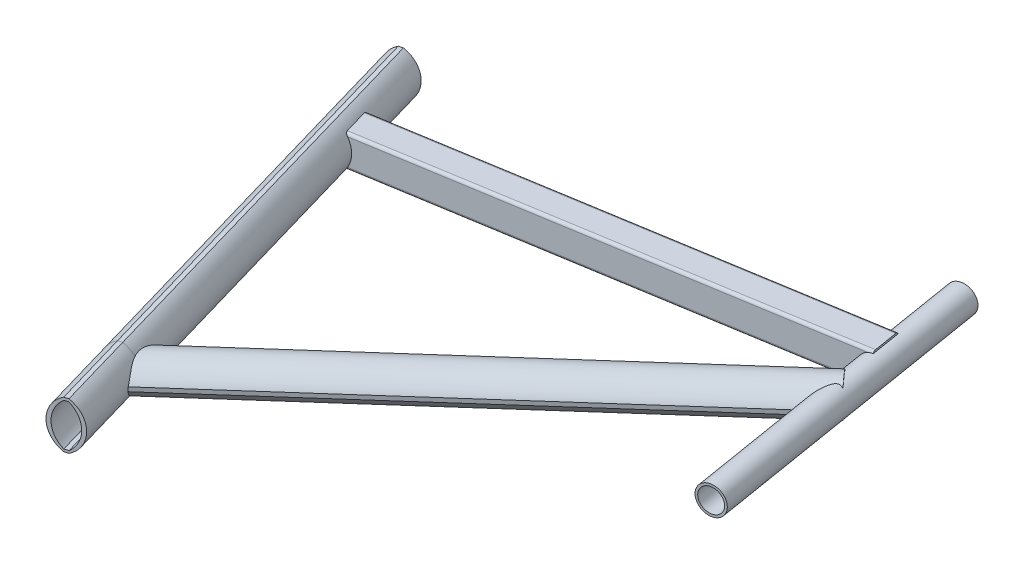
from build123d import *

# Parameters (mm, degrees)
SKETCH12_R                         = 15
SKETCH12_R_2                       = 12.5
BACK_FRAME_BACK_FRAME_1_DEPTH      = 439.089643257
SKETCH13_R                         = 15
SKETCH13_R_2                       = 12.5
BACK_FRAME_BACK_FRAME_2_DEPTH      = 324.083071196
TOP_FRAME_TOP_TUBE_1_DEPTH         = 505
LOWER_FRAME_BOTTOM_FRAME_1_DEPTH   = 547.875918564
LOWER_FRAME_BOTTOM_FRAME_2_DEPTH   = 84.118367958
LOWER_FRAME_BOTTOM_FRAME_2_2_DEPTH = 439.089643257


with BuildPart() as part:
    # Sketch12 → Back frame BACK FRAME(1) (new body)
    with BuildSketch(Plane(origin=(50.198693417, 0, 91.722962081), x_dir=(-0.9604190458168814, 0, 0.27855925120553954), z_dir=(-0.2785592512055396, 0, -0.9604190458168815))):
        Circle(SKETCH12_R)
        Circle(SKETCH12_R_2, mode=Mode.SUBTRACT)
    extrude(amount=BACK_FRAME_BACK_FRAME_1_DEPTH)


with BuildPart() as body_2:
    # Sketch13 → Back frame BACK FRAME(2) (new body)
    with BuildSketch(Plane(origin=(435.437022891, 0, -422.182546606), x_dir=(0.9868188241922125, 0, -0.1618289474102196), z_dir=(0.1618289474102196, 0, 0.9868188241922125))):
        Circle(SKETCH13_R)
        Circle(SKETCH13_R_2, mode=Mode.SUBTRACT)
    extrude(amount=BACK_FRAME_BACK_FRAME_2_DEPTH)


with BuildPart() as body_3:
    # Sketch14 → Top frame TOP TUBE(1) (new body)
    with BuildSketch(Plane(origin=(-46.97621709, 0, -243.317552361), x_dir=(0, 1, 0), z_dir=(0.9868188241922123, 0, -0.1618289474102196))):
        with BuildLine():
            Line((-14.05, 16.15), (14.05, 16.15))
            ThreePointArc((14.05, 16.15), (16.171320344, 15.271320344), (17.05, 13.15))
            Line((17.05, 13.15), (17.05, -13.15))
            ThreePointArc((17.05, -13.15), (16.171320344, -15.271320344), (14.05, -16.15))
            Line((14.05, -16.15), (-14.05, -16.15))
            ThreePointArc((-14.05, -16.15), (-16.171320344, -15.271320344), (-17.05, -13.15))
            Line((-17.05, -13.15), (-17.05, 13.15))
            ThreePointArc((-17.05, 13.15), (-16.171320344, 15.271320344), (-14.05, 16.15))
        make_face()
        with BuildLine():
            Line((-9.5, 11.840175953), (9.5, 11.840175953))
            ThreePointArc((9.5, 11.840175953), (11.621320344, 10.961496297), (12.5, 8.840175953))
            Line((12.5, 8.840175953), (12.5, -8.840175953))
            ThreePointArc((12.5, -8.840175953), (11.621320344, -10.961496297), (9.5, -11.840175953))
            Line((9.5, -11.840175953), (-9.5, -11.840175953))
            ThreePointArc((-9.5, -11.840175953), (-11.621320344, -10.961496297), (-12.5, -8.840175953))
            Line((-12.5, -8.840175953), (-12.5, 8.840175953))
            ThreePointArc((-12.5, 8.840175953), (-11.621320344, 10.961496297), (-9.5, 11.840175953))
        make_face(mode=Mode.SUBTRACT)
    extrude(amount=TOP_FRAME_TOP_TUBE_1_DEPTH)


with BuildPart() as body_4:
    # Sketch17 → Lower frame BOTTOM FRAME(1) (new body)
    with BuildSketch(Plane(origin=(460.09796084, 0, -271.802295238), x_dir=(0, 1, 0), z_dir=(-0.7481607669438695, 0, 0.6635174954784245))):
        with BuildLine():
            Line((1.125, 25.2), (-1.125, 25.2))
            Line((-1.125, 25.2), (-3.375, 25.2))
            ThreePointArc((-3.375, 25.2), (-18.625, 0), (-3.375, -25.2))
            Line((-3.375, -25.2), (-1.125, -25.2))
            Line((-1.125, -25.2), (1.125, -25.2))
            ThreePointArc((1.125, -25.2), (16.375, 0), (1.125, 25.2))
        make_face()
        with BuildLine():
            Line((1.03963794, 22.329904981), (-0.96036206, 22.329904981))
            Line((-0.96036206, 22.329904981), (-3.21036206, 22.329904981))
            ThreePointArc((-3.21036206, 22.329904981), (-14.376912625, -0.108753071), (-3.46036206, -22.670095019))
            Line((-3.46036206, -22.670095019), (-1.21036206, -22.670095019))
            Line((-1.21036206, -22.670095019), (1.03963794, -22.670095019))
            ThreePointArc((1.03963794, -22.670095019), (12.080910019, -0.170095019), (1.03963794, 22.329904981))
        make_face(mode=Mode.SUBTRACT)
    extrude(amount=LOWER_FRAME_BOTTOM_FRAME_1_DEPTH)


with BuildPart() as body_5:
    # Sketch18 → Lower frame BOTTOM FRAME(2) (new body)
    with BuildSketch(Plane(origin=(50.198693417, 0, 91.722962081), x_dir=(-0.9604190458168814, 0, 0.27855925120553954), z_dir=(-0.2785592512055396, 0, -0.9604190458168815))):
        with BuildLine():
            Line((1.125, 25.2), (-1.125, 25.2))
            Line((-1.125, 25.2), (-3.375, 25.2))
            ThreePointArc((-3.375, 25.2), (-18.625, 0), (-3.375, -25.2))
            Line((-3.375, -25.2), (-1.125, -25.2))
            Line((-1.125, -25.2), (1.125, -25.2))
            ThreePointArc((1.125, -25.2), (16.375, 0), (1.125, 25.2))
        make_face()
        with BuildLine():
            Line((1.03963794, 22.329904981), (-0.96036206, 22.329904981))
            Line((-0.96036206, 22.329904981), (-3.21036206, 22.329904981))
            ThreePointArc((-3.21036206, 22.329904981), (-14.376912625, -0.108753071), (-3.46036206, -22.670095019))
            Line((-3.46036206, -22.670095019), (-1.21036206, -22.670095019))
            Line((-1.21036206, -22.670095019), (1.03963794, -22.670095019))
            ThreePointArc((1.03963794, -22.670095019), (12.080910019, -0.170095019), (1.03963794, 22.329904981))
        make_face(mode=Mode.SUBTRACT)
    extrude(amount=-LOWER_FRAME_BOTTOM_FRAME_2_DEPTH)


with BuildPart() as body_6:
    # Sketch18 on segment 2 (carried to segment 2) → Lower frame BOTTOM FRAME_2 2 (new body)
    with BuildSketch(Plane(origin=(50.198693417, 0, 91.722962081), x_dir=(-0.960419046, 0, 0.278559251), z_dir=(-0.278559251, 0, -0.960419046))):
        with BuildLine():
            Line((1.125, 25.2), (-1.125, 25.2))
            Line((-1.125, 25.2), (-3.375, 25.2))
            ThreePointArc((-3.375, 25.2), (-18.625, 0), (-3.375, -25.2))
            Line((-3.375, -25.2), (-1.125, -25.2))
            Line((-1.125, -25.2), (1.125, -25.2))
            ThreePointArc((1.125, -25.2), (16.375, 0), (1.125, 25.2))
        make_face()
        with BuildLine():
            Line((1.03963794, 22.329904981), (-0.96036206, 22.329904981))
            Line((-0.96036206, 22.329904981), (-3.21036206, 22.329904981))
            ThreePointArc((-3.21036206, 22.329904981), (-14.376912625, -0.108753071), (-3.46036206, -22.670095019))
            Line((-3.46036206, -22.670095019), (-1.21036206, -22.670095019))
            Line((-1.21036206, -22.670095019), (1.03963794, -22.670095019))
            ThreePointArc((1.03963794, -22.670095019), (12.080910019, -0.170095019), (1.03963794, 22.329904981))
        make_face(mode=Mode.SUBTRACT)
    extrude(amount=LOWER_FRAME_BOTTOM_FRAME_2_2_DEPTH)


solid = Compound([part.part, body_2.part, body_3.part, body_4.part, body_5.part, body_6.part])
